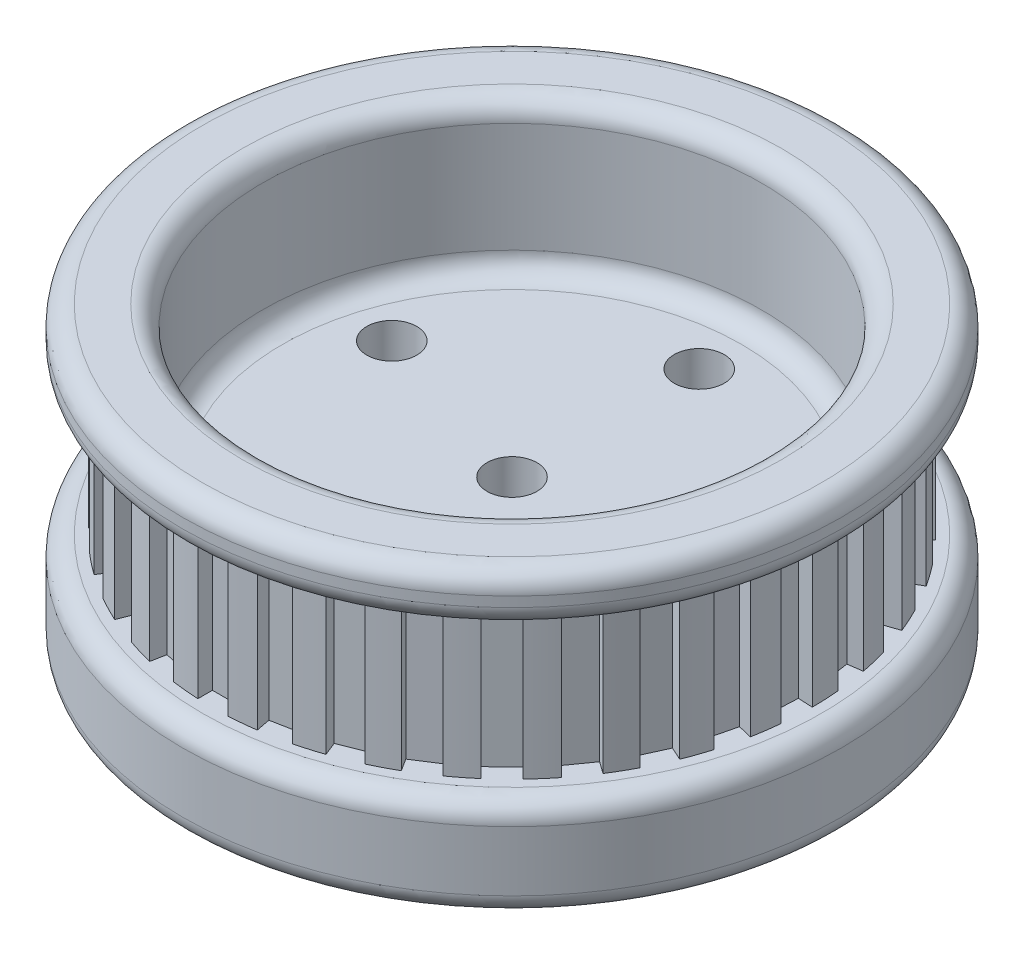
from build123d import *

# Parameters (mm, degrees)
SKETCH2_R          = 2.5
CUT_EXTRUDE1_DEPTH = 10
SKETCH3_W          = 3
SKETCH3_H          = 3
CUT_EXTRUDE2_DEPTH = 15
CIRPATTERN1_COUNT  = 33
FILLET3_R          = 2


with BuildPart() as part:
    # Sketch1 → Revolve1 (revolve)
    with BuildSketch(Plane.XY, mode=Mode.PRIVATE) as revolve1_sk:
        Polygon((25, 10), (25, 25), (33, 25), (33, 20), (30, 20), (30, 5), (33, 5), (33, -5), (25, -5), (25, 0), (0, 0), (0, 10), align=None)
    revolve(revolve1_sk.sketch.rotate(Axis((0, 0, 0), (0, 1, 0)), 90), axis=Axis((0, 0, 0), (0, 1, 0)))

    # Sketch2 → Cut-Extrude1 (cut)
    with BuildSketch(Plane(origin=(0, 10, 0), x_dir=(1, 0, 0), z_dir=(0, 1, 0))):
        with Locations(Location((0, 0, 0), (0, 0, 270))):
            Circle(SKETCH2_R)
        with Locations(Location((0, 18.75, 0), (0, 0, 270))):
            Circle(SKETCH2_R)
        with Locations(Location((17.832309681, 5.794068645, 0), (0, 0, 270))):
            Circle(SKETCH2_R)
        with Locations(Location((11.02097348, -15.169068645, 0), (0, 0, 270))):
            Circle(SKETCH2_R)
        with Locations(Location((-11.02097348, -15.169068645, 0), (0, 0, 270))):
            Circle(SKETCH2_R)
        with Locations(Location((-17.832309681, 5.794068645, 0), (0, 0, 270))):
            Circle(SKETCH2_R)
    extrude(amount=-CUT_EXTRUDE1_DEPTH, mode=Mode.SUBTRACT)

    # Sketch3 → Cut-Extrude2 (cut)
    with BuildSketch(Plane(origin=(0, 5, 0), x_dir=(1, 0, 0), z_dir=(0, 1, 0))):
        with Locations((0, -30)):
            Rectangle(SKETCH3_W, SKETCH3_H)
    cut_extrude2 = extrude(amount=CUT_EXTRUDE2_DEPTH, mode=Mode.SUBTRACT)

    # CirPattern1: Cut-Extrude2 ×33 about axis
    cirpattern1_axis = Axis((0, 0, 0), (0, 1, 0))
    for i in range(1, CIRPATTERN1_COUNT):
        add(cut_extrude2.rotate(cirpattern1_axis, i * 360 / CIRPATTERN1_COUNT), mode=Mode.SUBTRACT)

    # Fillet3
    fillet3_edges = [part.edges().sort_by_distance(p)[0] for p in [
        (0, -5, 25),
        (0, -5, 33),
        (0, 5, 33),
        (0, 20, 33),
        (0, 25, 33),
        (0, 25, 25),
        (0, 10, 25),
        (0, 0, 25),
    ]]
    fillet(fillet3_edges, radius=FILLET3_R)


solid = part.part
